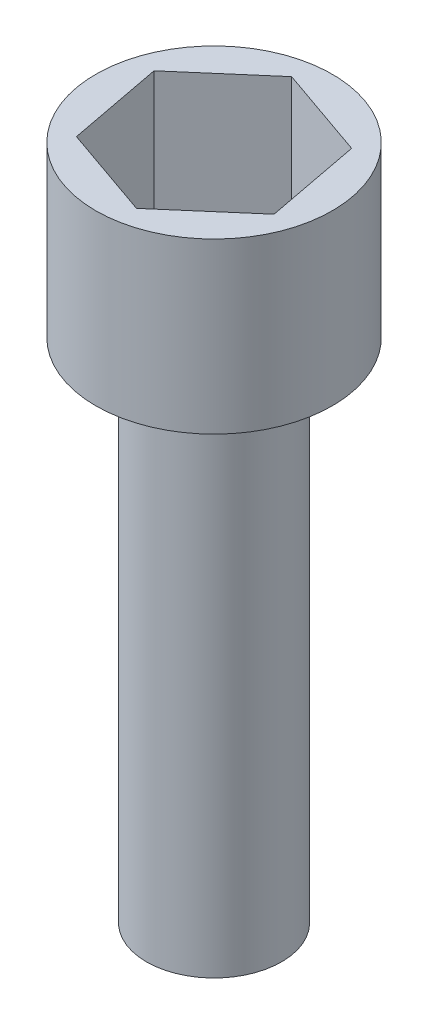
from build123d import *

# Parameters (mm, degrees)
ESQUISSE1_R             = 2
BOSS_EXTRU_2_DEPTH      = 15
ESQUISSE4_R             = 3.5
BOSS_EXTRU_5_DEPTH      = 5
ENL_V_MAT_EXTRU_3_DEPTH = 4


with BuildPart() as part:
    # Esquisse1 → Boss.-Extru.2 (new body)
    with BuildSketch(Plane(origin=(0, 0, 0), x_dir=(1, 0, 0), z_dir=(0, 1, 0))):
        with Locations(Location((0, 0, 0), (0, 0, 270))):
            Circle(ESQUISSE1_R)
    extrude(amount=BOSS_EXTRU_2_DEPTH)

    # Esquisse4 → Boss.-Extru.5 (add)
    with BuildSketch(Plane(origin=(0, 15, 0), x_dir=(1, 0, 0), z_dir=(0, 1, 0))):
        with Locations(Location((0, 0, 0), (0, 0, 270))):
            Circle(ESQUISSE4_R)
    extrude(amount=BOSS_EXTRU_5_DEPTH)

    # Esquisse6 → Enlèv. mat.-Extru.3 (cut)
    with BuildSketch(Plane(origin=(0, 20, 0), x_dir=(1, 0, 0), z_dir=(0, 1, 0))):
        Polygon((0.539972864, -2.835800176), (2.725861425, -0.950269871), (2.185888561, 1.885530305), (-0.539972864, 2.835800176), (-2.725861425, 0.950269871), (-2.185888561, -1.885530305), align=None)
    extrude(amount=-ENL_V_MAT_EXTRU_3_DEPTH, mode=Mode.SUBTRACT)


solid = part.part
